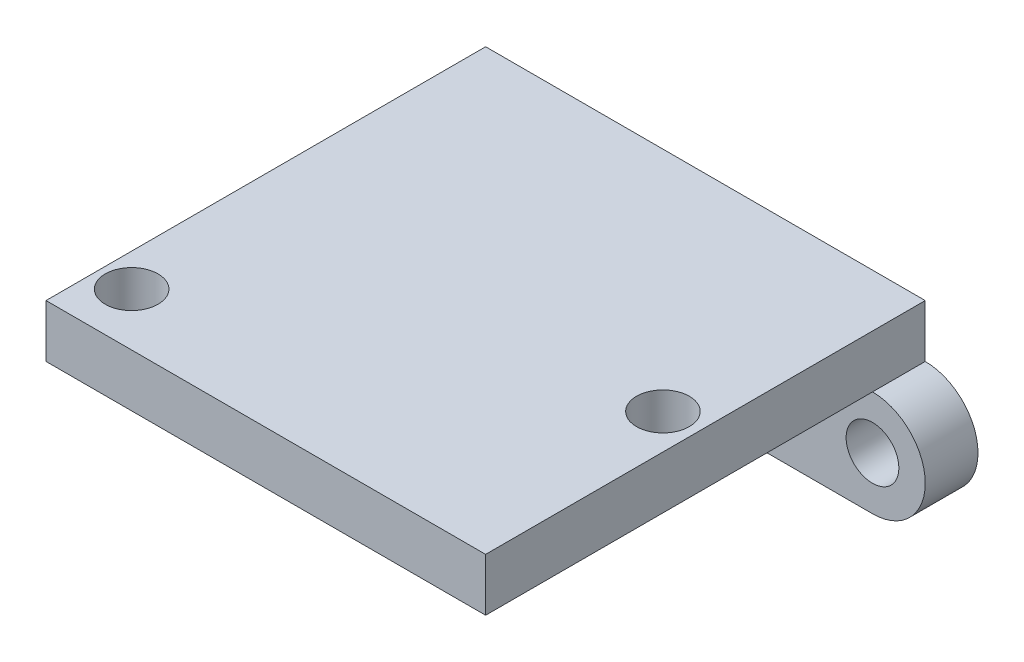
from build123d import *

# Parameters (mm, degrees)
SKETCH_1_R          = 1.5
EXTRUDE_1_DEPTH     = 3
EXTRUDE_START       = -3
SKETCH_2_W          = 25
SKETCH_2_H          = 3
EXTRUDE_2_DEPTH     = 25
SKETCH_8_R          = 1.5
CUT_EXTRUDE_1_DEPTH = 31.020826105


with BuildPart() as part:
    # 草图1 → 凸台-拉伸1 (new body)
    with BuildSketch(Plane.XY):
        with BuildLine():
            Line((12.5, 3), (-12.5, 3))
            ThreePointArc((-12.5, 3), (-15.5, 0), (-12.5, -3))
            Line((-12.5, -3), (12.5, -3))
            ThreePointArc((12.5, -3), (15.5, 0), (12.5, 3))
        make_face()
        with Locations((-12.5, 0)):
            Circle(SKETCH_1_R, mode=Mode.SUBTRACT)
        with Locations((12.5, 0)):
            Circle(SKETCH_1_R, mode=Mode.SUBTRACT)
    extrude(amount=EXTRUDE_1_DEPTH)

    # 草图2 → 凸台-拉伸2 (add)
    with BuildSketch(Plane.XY.offset(3).offset(EXTRUDE_START)):
        with Locations((0, 4.5)):
            Rectangle(SKETCH_2_W, SKETCH_2_H)
    extrude(amount=EXTRUDE_2_DEPTH)

    # 草图8 → 切除-拉伸1 (cut, through all)
    with BuildSketch(Plane.XZ.offset(-3)):
        with Locations(Location((-10.629379797, 22, 0), (0, 0, 270))):
            Circle(SKETCH_8_R)
        with Locations(Location((10.50249981, 12.920150648, 0), (0, 0, 270))):
            Circle(SKETCH_8_R)
    extrude(amount=-CUT_EXTRUDE_1_DEPTH, mode=Mode.SUBTRACT)


solid = part.part
